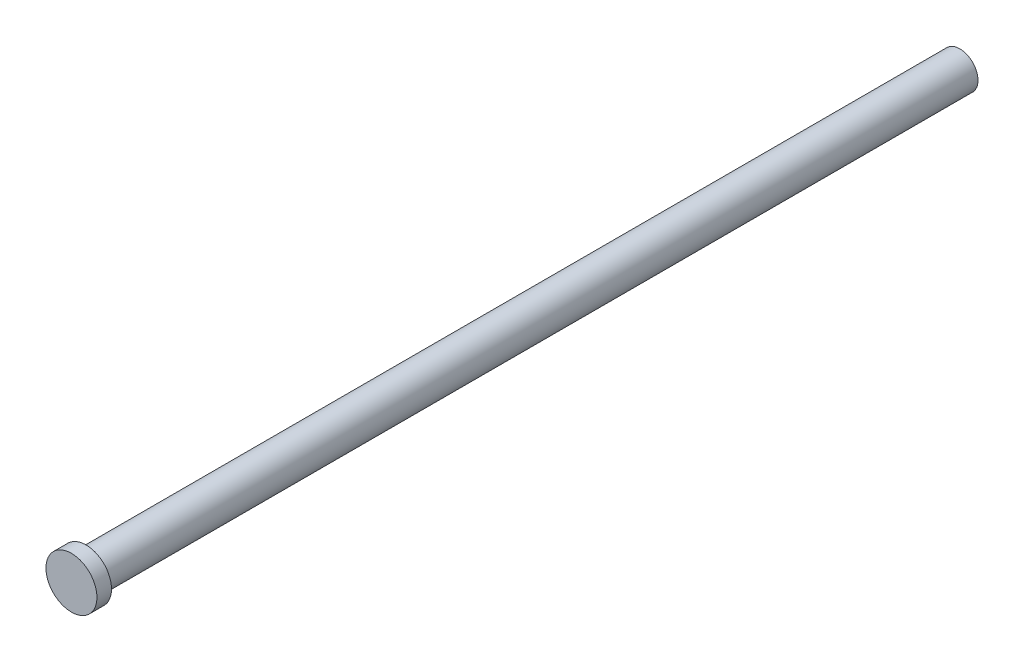
from build123d import *

# Parameters (mm, degrees)
SKETCH1_R           = 12.5
BOSS_EXTRUDE1_DEPTH = 600
SKETCH2_R           = 17.5
BOSS_EXTRUDE2_DEPTH = 10


with BuildPart() as part:
    # Sketch1 → Boss-Extrude1 (new body)
    with BuildSketch(Plane.XY):
        Circle(SKETCH1_R)
    extrude(amount=BOSS_EXTRUDE1_DEPTH)

    # Sketch2 → Boss-Extrude2 (add)
    with BuildSketch(Plane.XY.offset(600)):
        Circle(SKETCH2_R)
    extrude(amount=BOSS_EXTRUDE2_DEPTH)


solid = part.part
